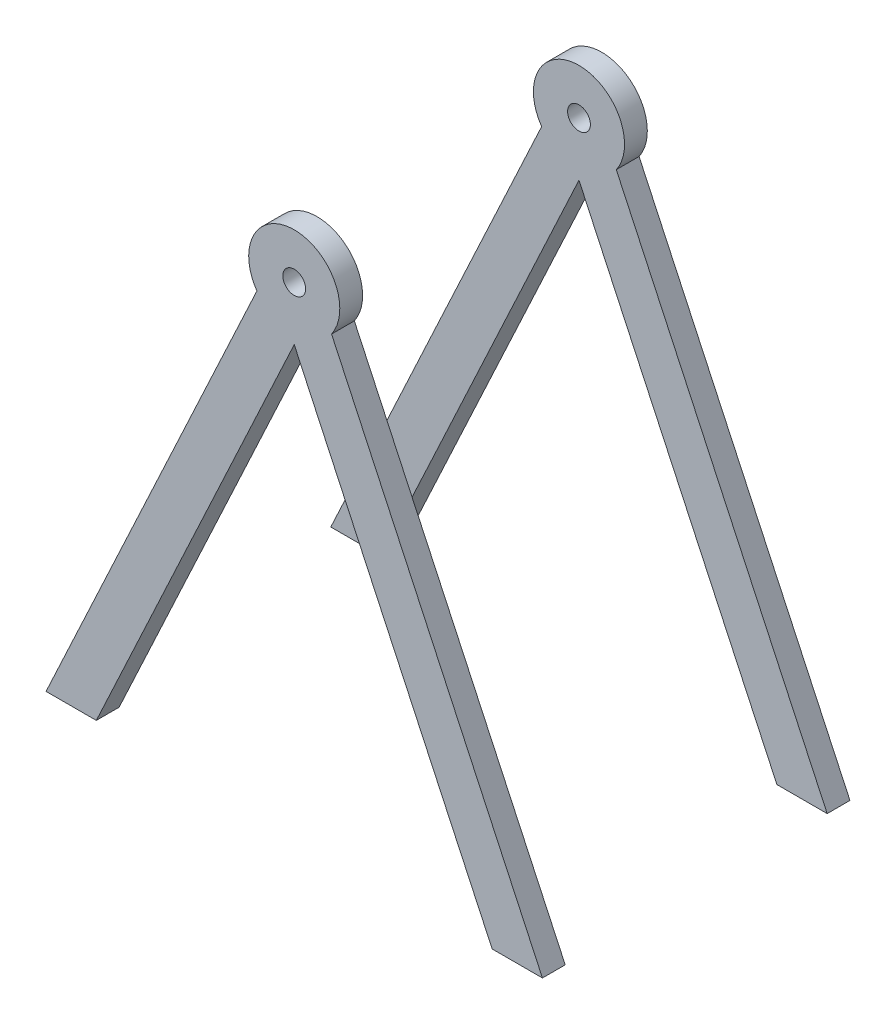
from build123d import *

# Parameters (mm, degrees)
SKETCH1_R           = 5
BOSS_EXTRUDE1_DEPTH = 10


with BuildPart() as part:
    # Sketch1 → Boss-Extrude1 (new body)
    with BuildSketch(Plane.XY):
        with BuildLine():
            Line((-16.383040886, 198.528471273), (-108.958387402, 0))
            Line((-108.958387402, 0), (-86.890829023, 0))
            Line((-86.890829023, 0), (0, 186.337984168))
            Line((0, 186.337984168), (86.890829023, 0))
            Line((86.890829023, 0), (108.958387402, 0))
            Line((108.958387402, 0), (16.383040886, 198.528471273))
            ThreePointArc((16.383040886, 198.528471273), (0, 230), (-16.383040886, 198.528471273))
        make_face()
        with Locations((0, 210)):
            Circle(SKETCH1_R, mode=Mode.SUBTRACT)
    extrude(amount=BOSS_EXTRUDE1_DEPTH)


with BuildPart() as body_2:
    # Mirror2: mirrored copy
    add(part.part.mirror(Plane(origin=(0, 0, -57.5), x_dir=(1, 0, 0), z_dir=(0, 0, -1))))


solid = Compound([part.part, body_2.part])
